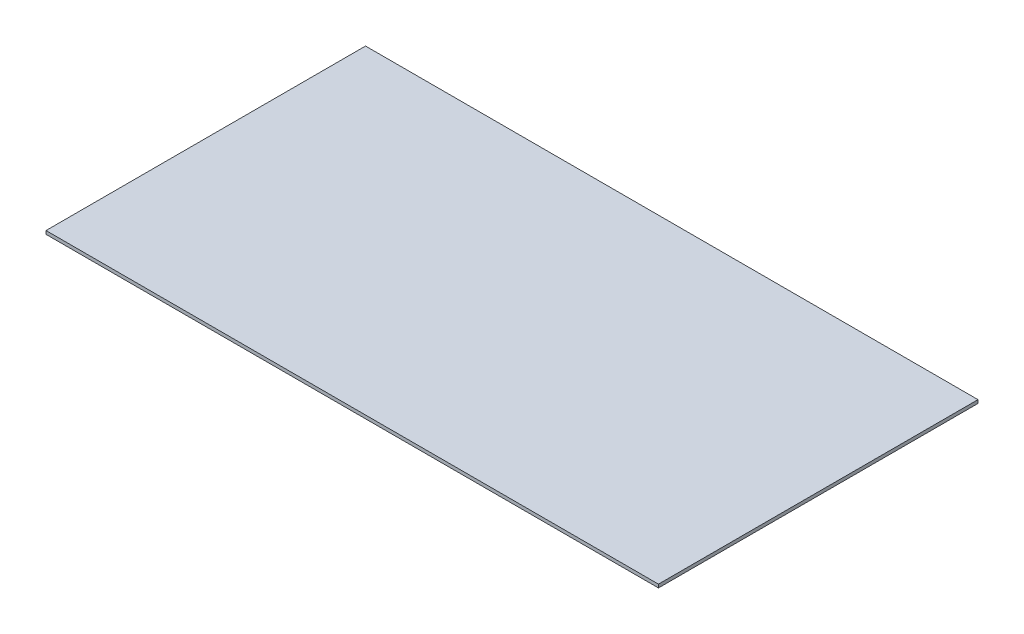
from build123d import *

# Parameters (mm, degrees)
SKETCH1_W           = 1168.4
SKETCH1_H           = 609.6
BOSS_EXTRUDE1_DEPTH = 6.35


with BuildPart() as part:
    # Sketch1 → Boss-Extrude1 (new body)
    with BuildSketch(Plane(origin=(0, 0, 0), x_dir=(1, 0, 0), z_dir=(0, 1, 0))):
        Rectangle(SKETCH1_W, SKETCH1_H)
    extrude(amount=BOSS_EXTRUDE1_DEPTH)


solid = part.part
